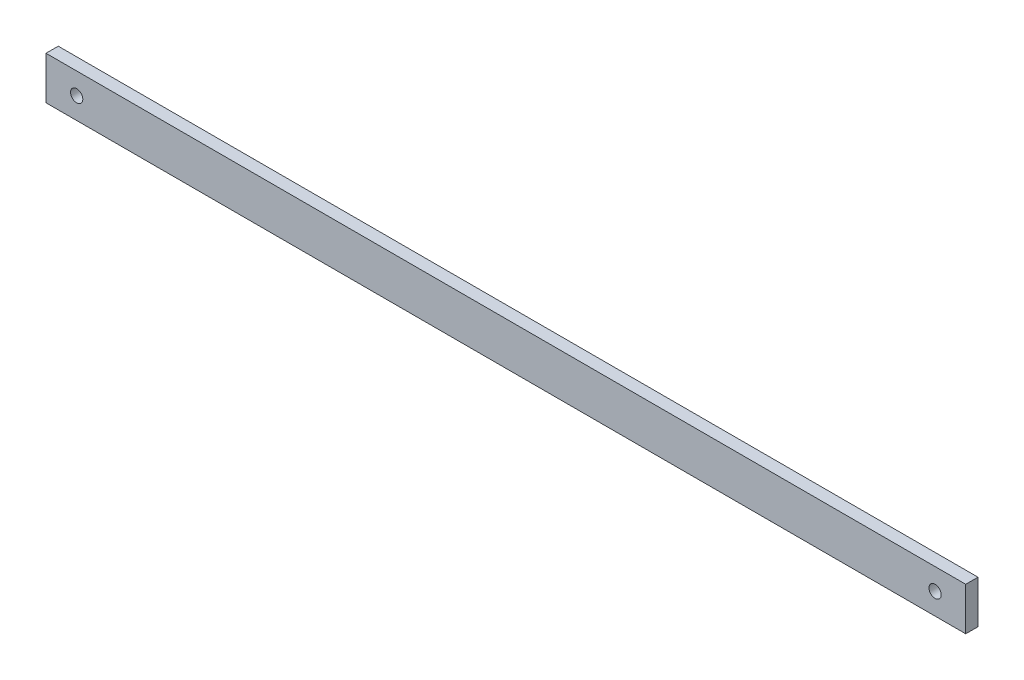
from build123d import *

# Parameters (mm, degrees)
SKETCH1_W           = 150
SKETCH1_H           = 7
SKETCH1_R           = 1
BOSS_EXTRUDE1_DEPTH = 2


with BuildPart() as part:
    # Sketch1 → Boss-Extrude1 (new body)
    with BuildSketch(Plane.XY):
        Rectangle(SKETCH1_W, SKETCH1_H)
        with Locations((-70, 0)):
            Circle(SKETCH1_R, mode=Mode.SUBTRACT)
        with Locations(Location((70, 0, 0), (0, 0, 180))):
            Circle(SKETCH1_R, mode=Mode.SUBTRACT)
    extrude(amount=BOSS_EXTRUDE1_DEPTH)


solid = part.part
